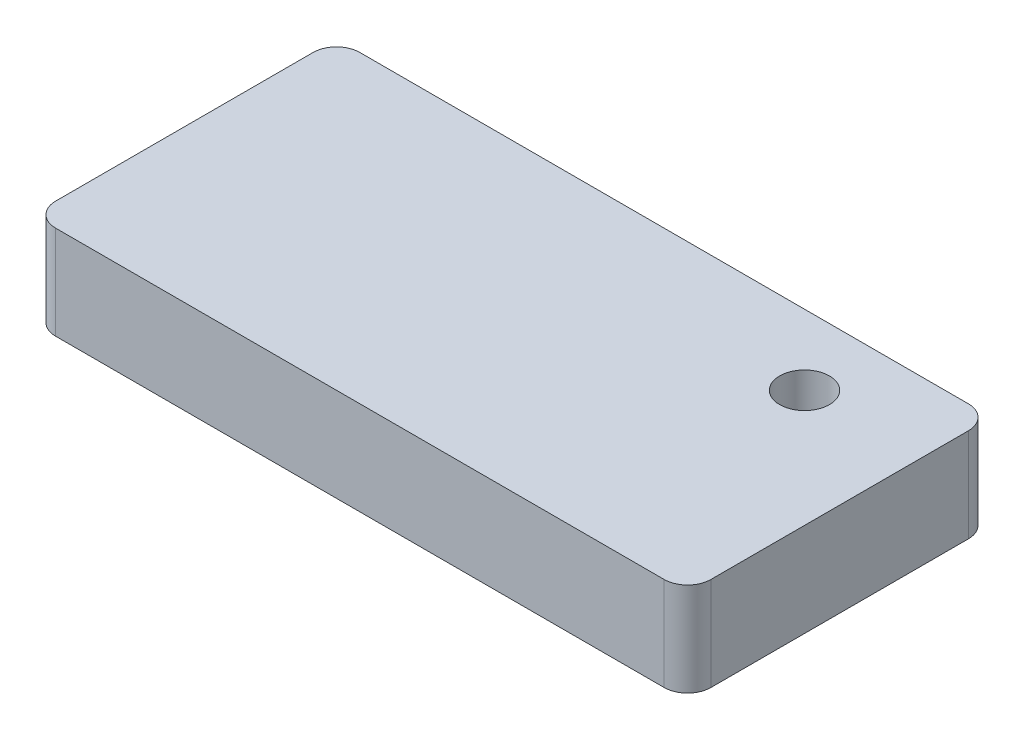
from build123d import *

# Parameters (mm, degrees)
SKETCH1_W               = 88.9
SKETCH1_H               = 41.275
BOSS_EXTRUDE1_DEPTH     = 12.7
F_1_4_CLEARANCE_HOLE1_D = 6.7564
FILLET1_R               = 3.175


with BuildPart() as part:
    # Sketch1 → Boss-Extrude1 (new body)
    with BuildSketch(Plane(origin=(0, 0, 0), x_dir=(1, 0, 0), z_dir=(0, 1, 0))):
        with Locations((44.45, 20.6375)):
            Rectangle(SKETCH1_W, SKETCH1_H)
    extrude(amount=BOSS_EXTRUDE1_DEPTH)

    # 1/4 Clearance Hole1 (through all)
    with Locations(Plane(origin=(0, 12.7, 0), x_dir=(1, 0, 0), z_dir=(0, 1, 0))):
        with Locations((73.025, 31.75)):
            Hole(F_1_4_CLEARANCE_HOLE1_D / 2)

    # Fillet1
    fillet1_edges = [part.edges().sort_by_distance(p)[0] for p in [
        (0, 6.35, -41.275),
        (88.9, 6.35, -41.275),
        (88.9, 6.35, 0),
        (0, 6.35, 0),
    ]]
    fillet(fillet1_edges, radius=FILLET1_R)


solid = part.part
